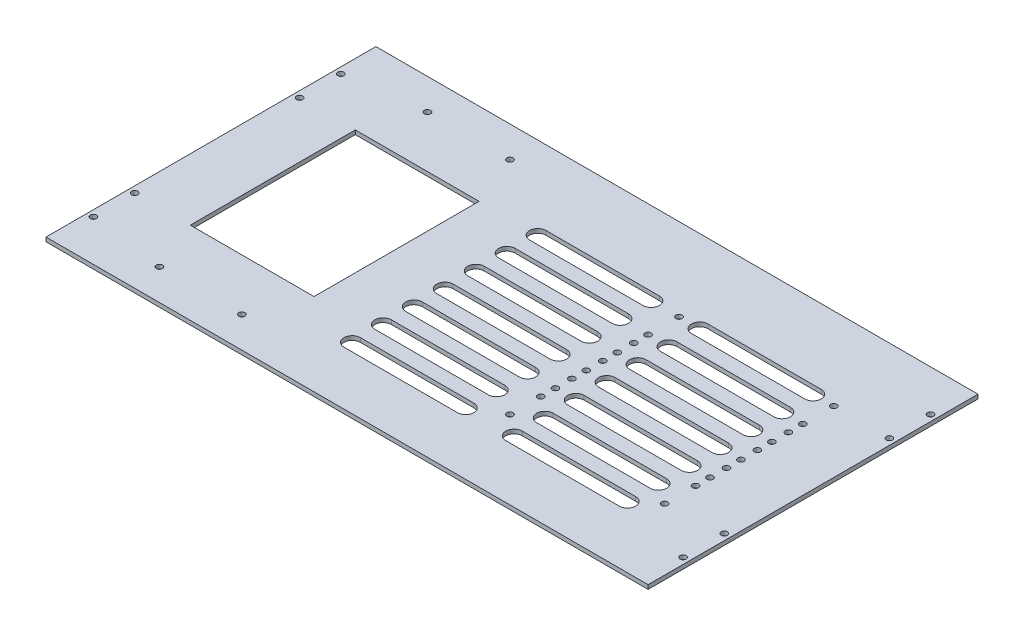
from build123d import *

# Parameters (mm, degrees)
SKETCH_1_W      = 292
SKETCH_1_H      = 160
SKETCH_1_R      = 1.5
SKETCH_1_W_2    = 60
SKETCH_1_H_2    = 80
EXTRUDE_1_DEPTH = 2


with BuildPart() as part:
    # 草图1 → 凸台-拉伸1 (new body)
    with BuildSketch(Plane(origin=(0, 0, 0), x_dir=(1, 0, 0), z_dir=(0, 1, 0))):
        with Locations((146, 80)):
            Rectangle(SKETCH_1_W, SKETCH_1_H)
        with Locations(Location((3, 140, 0), (0, 0, 270))):
            Circle(SKETCH_1_R, mode=Mode.SUBTRACT)
        with Locations(Location((3, 120, 0), (0, 0, 270))):
            Circle(SKETCH_1_R, mode=Mode.SUBTRACT)
        with Locations(Location((3, 40, 0), (0, 0, 270))):
            Circle(SKETCH_1_R, mode=Mode.SUBTRACT)
        with Locations(Location((3, 20, 0), (0, 0, 270))):
            Circle(SKETCH_1_R, mode=Mode.SUBTRACT)
        with Locations(Location((289, 20, 0), (0, 0, 90))):
            Circle(SKETCH_1_R, mode=Mode.SUBTRACT)
        with Locations(Location((289, 40, 0), (0, 0, 90))):
            Circle(SKETCH_1_R, mode=Mode.SUBTRACT)
        with Locations(Location((289, 120, 0), (0, 0, 90))):
            Circle(SKETCH_1_R, mode=Mode.SUBTRACT)
        with Locations(Location((289, 140, 0), (0, 0, 90))):
            Circle(SKETCH_1_R, mode=Mode.SUBTRACT)
        with Locations(Location((187, 120, 0), (0, 0, 270))):
            Circle(SKETCH_1_R, mode=Mode.SUBTRACT)
        with Locations(Location((262, 120, 0), (0, 0, 270))):
            Circle(SKETCH_1_R, mode=Mode.SUBTRACT)
        with Locations(Location((262, 98, 0), (0, 0, 270))):
            Circle(SKETCH_1_R, mode=Mode.SUBTRACT)
        with Locations(Location((187, 98, 0), (0, 0, 270))):
            Circle(SKETCH_1_R, mode=Mode.SUBTRACT)
        with Locations(Location((187, 105, 0), (0, 0, 270))):
            Circle(SKETCH_1_R, mode=Mode.SUBTRACT)
        with Locations(Location((262, 105, 0), (0, 0, 270))):
            Circle(SKETCH_1_R, mode=Mode.SUBTRACT)
        with Locations(Location((187, 83, 0), (0, 0, 270))):
            Circle(SKETCH_1_R, mode=Mode.SUBTRACT)
        with Locations(Location((262, 83, 0), (0, 0, 270))):
            Circle(SKETCH_1_R, mode=Mode.SUBTRACT)
        with Locations(Location((187, 90, 0), (0, 0, 270))):
            Circle(SKETCH_1_R, mode=Mode.SUBTRACT)
        with Locations(Location((262, 90, 0), (0, 0, 270))):
            Circle(SKETCH_1_R, mode=Mode.SUBTRACT)
        with Locations(Location((187, 68, 0), (0, 0, 270))):
            Circle(SKETCH_1_R, mode=Mode.SUBTRACT)
        with Locations(Location((262, 68, 0), (0, 0, 270))):
            Circle(SKETCH_1_R, mode=Mode.SUBTRACT)
        with Locations(Location((187, 75, 0), (0, 0, 270))):
            Circle(SKETCH_1_R, mode=Mode.SUBTRACT)
        with Locations(Location((262, 75, 0), (0, 0, 270))):
            Circle(SKETCH_1_R, mode=Mode.SUBTRACT)
        with Locations(Location((187, 53, 0), (0, 0, 270))):
            Circle(SKETCH_1_R, mode=Mode.SUBTRACT)
        with Locations(Location((262, 53, 0), (0, 0, 270))):
            Circle(SKETCH_1_R, mode=Mode.SUBTRACT)
        with Locations(Location((187, 60, 0), (0, 0, 270))):
            Circle(SKETCH_1_R, mode=Mode.SUBTRACT)
        with Locations(Location((262, 60, 0), (0, 0, 270))):
            Circle(SKETCH_1_R, mode=Mode.SUBTRACT)
        with Locations(Location((187, 38, 0), (0, 0, 270))):
            Circle(SKETCH_1_R, mode=Mode.SUBTRACT)
        with Locations(Location((262, 38, 0), (0, 0, 270))):
            Circle(SKETCH_1_R, mode=Mode.SUBTRACT)
        with Locations(Location((40, 145, 0), (0, 0, 270))):
            Circle(SKETCH_1_R, mode=Mode.SUBTRACT)
        with Locations(Location((80, 145, 0), (0, 0, 270))):
            Circle(SKETCH_1_R, mode=Mode.SUBTRACT)
        with Locations(Location((40, 15, 0), (0, 0, 270))):
            Circle(SKETCH_1_R, mode=Mode.SUBTRACT)
        with Locations(Location((80, 15, 0), (0, 0, 270))):
            Circle(SKETCH_1_R, mode=Mode.SUBTRACT)
        with Locations((60, 80)):
            Rectangle(SKETCH_1_W_2, SKETCH_1_H_2, mode=Mode.SUBTRACT)
        with BuildLine():
            Line((197, 124), (252, 124))
            ThreePointArc((252, 124), (256, 120), (252, 116))
            Line((252, 116), (197, 116))
            ThreePointArc((197, 116), (193, 120), (197, 124))
        make_face(mode=Mode.SUBTRACT)
        with BuildLine():
            Line((197, 101), (252, 101))
            ThreePointArc((252, 101), (256, 105), (252, 109))
            Line((252, 109), (197, 109))
            ThreePointArc((197, 109), (193, 105), (197, 101))
        make_face(mode=Mode.SUBTRACT)
        with BuildLine():
            Line((197, 86), (252, 86))
            ThreePointArc((252, 86), (256, 90), (252, 94))
            Line((252, 94), (197, 94))
            ThreePointArc((197, 94), (193, 90), (197, 86))
        make_face(mode=Mode.SUBTRACT)
        with BuildLine():
            Line((197, 71), (252, 71))
            ThreePointArc((252, 71), (256, 75), (252, 79))
            Line((252, 79), (197, 79))
            ThreePointArc((197, 79), (193, 75), (197, 71))
        make_face(mode=Mode.SUBTRACT)
        with BuildLine():
            Line((197, 56), (252, 56))
            ThreePointArc((252, 56), (256, 60), (252, 64))
            Line((252, 64), (197, 64))
            ThreePointArc((197, 64), (193, 60), (197, 56))
        make_face(mode=Mode.SUBTRACT)
        with BuildLine():
            Line((197, 49), (252, 49))
            ThreePointArc((252, 49), (256, 45), (252, 41))
            Line((252, 41), (197, 41))
            ThreePointArc((197, 41), (193, 45), (197, 49))
        make_face(mode=Mode.SUBTRACT)
        with BuildLine():
            Line((197, 34), (252, 34))
            ThreePointArc((252, 34), (256, 30), (252, 26))
            Line((252, 26), (197, 26))
            ThreePointArc((197, 26), (193, 30), (197, 34))
        make_face(mode=Mode.SUBTRACT)
        with BuildLine():
            Line((118.5, 116), (173.5, 116))
            ThreePointArc((173.5, 116), (177.5, 120), (173.5, 124))
            Line((173.5, 124), (118.5, 124))
            ThreePointArc((118.5, 124), (114.5, 120), (118.5, 116))
        make_face(mode=Mode.SUBTRACT)
        with BuildLine():
            Line((118.5, 109), (173.5, 109))
            ThreePointArc((173.5, 109), (177.5, 105), (173.5, 101))
            Line((173.5, 101), (118.5, 101))
            ThreePointArc((118.5, 101), (114.5, 105), (118.5, 109))
        make_face(mode=Mode.SUBTRACT)
        with BuildLine():
            Line((118.5, 94), (173.5, 94))
            ThreePointArc((173.5, 94), (177.5, 90), (173.5, 86))
            Line((173.5, 86), (118.5, 86))
            ThreePointArc((118.5, 86), (114.5, 90), (118.5, 94))
        make_face(mode=Mode.SUBTRACT)
        with BuildLine():
            Line((118.5, 79), (173.5, 79))
            ThreePointArc((173.5, 79), (177.5, 75), (173.5, 71))
            Line((173.5, 71), (118.5, 71))
            ThreePointArc((118.5, 71), (114.5, 75), (118.5, 79))
        make_face(mode=Mode.SUBTRACT)
        with BuildLine():
            Line((118.5, 64), (173.5, 64))
            ThreePointArc((173.5, 64), (177.5, 60), (173.5, 56))
            Line((173.5, 56), (118.5, 56))
            ThreePointArc((118.5, 56), (114.5, 60), (118.5, 64))
        make_face(mode=Mode.SUBTRACT)
        with BuildLine():
            Line((118.5, 49), (173.5, 49))
            ThreePointArc((173.5, 49), (177.5, 45), (173.5, 41))
            Line((173.5, 41), (118.5, 41))
            ThreePointArc((118.5, 41), (114.5, 45), (118.5, 49))
        make_face(mode=Mode.SUBTRACT)
        with BuildLine():
            Line((118.5, 34), (173.5, 34))
            ThreePointArc((173.5, 34), (177.5, 30), (173.5, 26))
            Line((173.5, 26), (118.5, 26))
            ThreePointArc((118.5, 26), (114.5, 30), (118.5, 34))
        make_face(mode=Mode.SUBTRACT)
    extrude(amount=EXTRUDE_1_DEPTH)


solid = part.part
